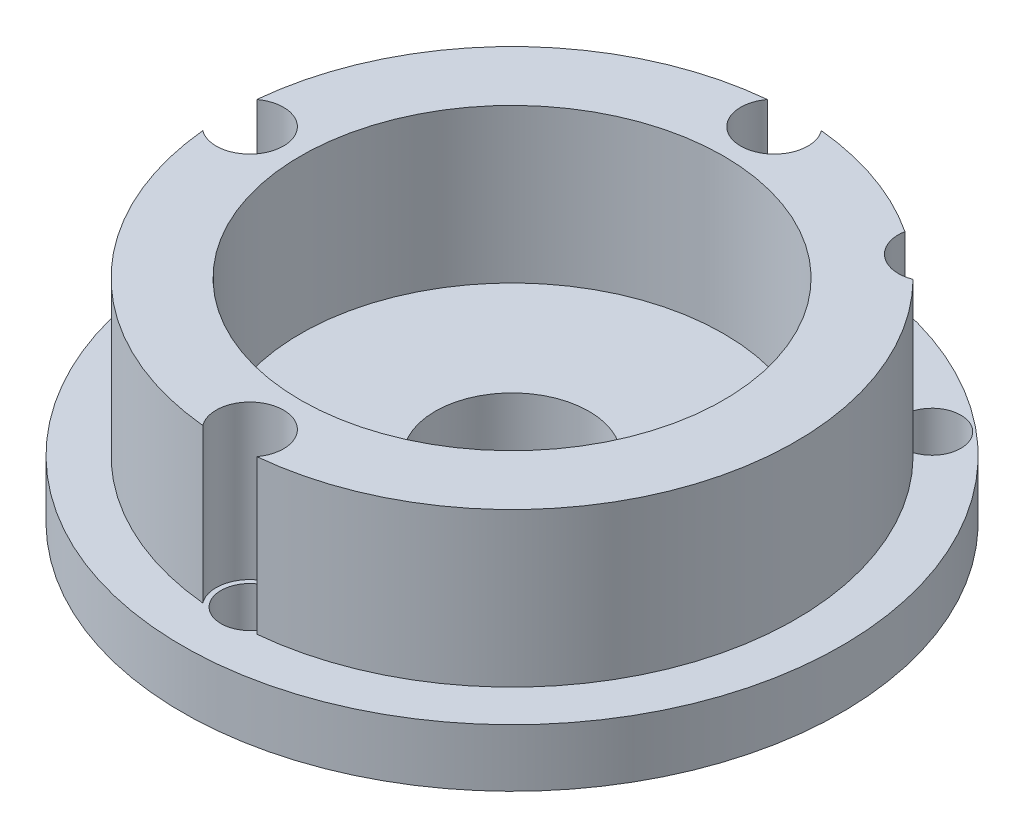
from build123d import *

# Parameters (mm, degrees)
CROQUIS2_R                   = 1.5
CORTAR_EXTRUIR1_DEPTH        = 10
CROQUIS3_R                   = 1.5
SALIENTE_EXTRUIR1_DEPTH      = 3
CROQUIS4_R                   = 1.5
CORTAR_EXTRUIR2_DEPTH        = 10
SALIENTE_EXTRUIR2_DEPTH      = 4
SALIENTE_EXTRUIR2_DEPTH_BACK = 4
CROQUIS5_R                   = 14.75
CROQUIS5_R_2                 = 11.75
CORTAR_EXTRUIR3_START        = -12
CROQUIS6_R                   = 1.5
CORTAR_EXTRUIR3_DEPTH        = 12
CROQUIS8_R                   = 10.142857143
CORTAR_EXTRUIR4_DEPTH        = 9
CROQUIS9_R                   = 1.75
CORTAR_EXTRUIR6_DEPTH        = 8
CROQUIS10_R                  = 11.75
CROQUIS10_R_2                = 11.125
SALIENTE_EXTRUIR3_DEPTH      = 10
CROQUIS11_R                  = 11.125
CROQUIS11_R_2                = 11
SALIENTE_EXTRUIR4_DEPTH      = 10


with BuildPart() as part:
    # Croquis1 → Revolución1 (revolve)
    with BuildSketch(Plane.XY, mode=Mode.PRIVATE) as revoluci_n1_sk:
        Polygon((-4, 0), (-4, 7), (-5, 7), (-10.142857143, 3), (-17.142857143, 3), (-17.142857143, 0), (-14, 0), align=None)
    revolve(revoluci_n1_sk.sketch.rotate(Axis((0, 0, 0), (0, 1, 0)), 270), axis=Axis((0, 0, 0), (0, 1, 0)))

    # Croquis2 → Cortar-Extruir1 (cut)
    with BuildSketch(Plane(origin=(0, 3, 0), x_dir=(1, 0, 0), z_dir=(0, 1, 0))):
        with Locations(Location((0, 13.64, 0), (0, 0, 270))):
            Circle(CROQUIS2_R)
        with Locations(Location((13.64, 0, 0), (0, 0, 270))):
            Circle(CROQUIS2_R)
        with Locations(Location((0, -13.64, 0), (0, 0, 270))):
            Circle(CROQUIS2_R)
        with Locations(Location((-13.64, 0, 0), (0, 0, 270))):
            Circle(CROQUIS2_R)
    extrude(amount=-CORTAR_EXTRUIR1_DEPTH, mode=Mode.SUBTRACT)

    # Croquis3 → Saliente-Extruir1 (add)
    with BuildSketch(Plane(origin=(0, 3, 0), x_dir=(1, 0, 0), z_dir=(0, 1, 0))):
        with Locations((13.64, 0)):
            Circle(CROQUIS3_R)
    extrude(amount=-SALIENTE_EXTRUIR1_DEPTH)

    # Croquis4 → Cortar-Extruir2 (cut)
    with BuildSketch(Plane(origin=(0, 0, 0), x_dir=(-1, 0, 0), z_dir=(0, -1, 0))):
        with Locations(Location((-9.844736786, 11.997981397, 0), (0, 0, 90))):
            Circle(CROQUIS4_R)
    extrude(amount=-CORTAR_EXTRUIR2_DEPTH, mode=Mode.SUBTRACT)

    # Croquis5 → Saliente-Extruir2 (add, two sides: drawn at the far end of the back side and taken through both)
    with BuildSketch(Plane(origin=(0, 7, 0), x_dir=(1, 0, 0), z_dir=(0, 1, 0)).offset(-SALIENTE_EXTRUIR2_DEPTH_BACK)):
        with Locations(Location((0, 0, 0), (0, 0, 85.923723928))):
            Circle(CROQUIS5_R)
        with Locations(Location((0, 0, 0), (0, 0, 270))):
            Circle(CROQUIS5_R_2, mode=Mode.SUBTRACT)
    extrude(amount=SALIENTE_EXTRUIR2_DEPTH + SALIENTE_EXTRUIR2_DEPTH_BACK)

    # Croquis6 → Cortar-Extruir3 (cut)
    with BuildSketch(Plane(origin=(0, 0, 0), x_dir=(-1, 0, 0), z_dir=(0, -1, 0)).offset(CORTAR_EXTRUIR3_START)):
        with Locations(Location((13.64, 0, 0), (0, 0, 270))):
            Circle(CROQUIS6_R)
        with Locations(Location((0, -13.64, 0), (0, 0, 270))):
            Circle(CROQUIS6_R)
        with Locations(Location((-9.844736786, 11.997981397, 0), (0, 0, 90))):
            Circle(CROQUIS6_R)
        with Locations(Location((0, 13.64, 0), (0, 0, 270))):
            Circle(CROQUIS6_R)
    extrude(amount=CORTAR_EXTRUIR3_DEPTH, mode=Mode.SUBTRACT)

    # Croquis8 → Cortar-Extruir4 (cut)
    with BuildSketch(Plane(origin=(0, 3, 0), x_dir=(1, 0, 0), z_dir=(0, 1, 0))):
        Circle(CROQUIS8_R)
    extrude(amount=CORTAR_EXTRUIR4_DEPTH, mode=Mode.SUBTRACT)

    # Croquis9 → Cortar-Extruir6 (cut)
    with BuildSketch(Plane(origin=(0, 11, 0), x_dir=(1, 0, 0), z_dir=(0, 1, 0))):
        with Locations((9.844736786, 11.997981397)):
            Circle(CROQUIS9_R)
        with Locations((0, 13.64)):
            Circle(CROQUIS9_R)
        with Locations((-13.64, 0)):
            Circle(CROQUIS9_R)
        with Locations((0, -13.64)):
            Circle(CROQUIS9_R)
    extrude(amount=-CORTAR_EXTRUIR6_DEPTH, mode=Mode.SUBTRACT)

    # Croquis10 → Saliente-Extruir3 (add)
    with BuildSketch(Plane(origin=(0, 11, 0), x_dir=(1, 0, 0), z_dir=(0, 1, 0))):
        Circle(CROQUIS10_R)
        with Locations(Location((0, 0, 0), (0, 0, 270))):
            Circle(CROQUIS10_R_2, mode=Mode.SUBTRACT)
    extrude(amount=-SALIENTE_EXTRUIR3_DEPTH)

    # Croquis11 → Saliente-Extruir4 (add)
    with BuildSketch(Plane(origin=(0, 11, 0), x_dir=(1, 0, 0), z_dir=(0, 1, 0))):
        Circle(CROQUIS11_R)
        with Locations(Location((0, 0, 0), (0, 0, 270))):
            Circle(CROQUIS11_R_2, mode=Mode.SUBTRACT)
    extrude(amount=-SALIENTE_EXTRUIR4_DEPTH)


solid = part.part
